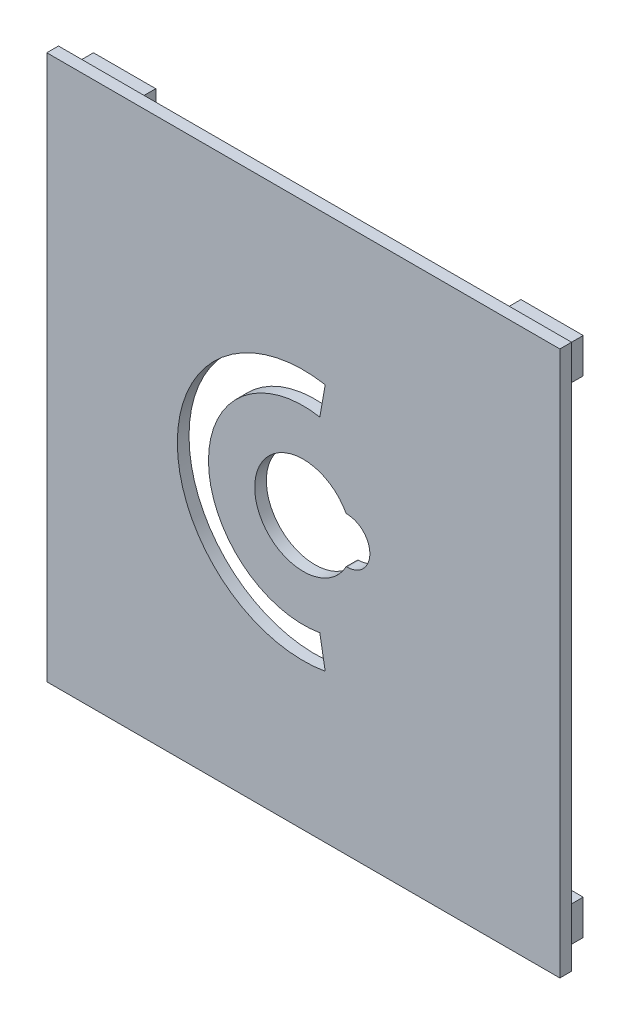
from build123d import *

# Parameters (mm, degrees)
SKETCH1_W                 = 65.925
SKETCH1_H                 = 70
BOSS_EXTRUDE1_DEPTH       = 1.5
CUT_EXTRUDE1_REACH        = 137.268
SKETCH4_W                 = 8
SKETCH4_H                 = 4.5
SKETCH4_W_2               = 5
SKETCH4_H_2               = 1.5
BOSS_EXTRUDE2_DEPTH       = 3
MIRROR2_COPY_1_SKETCH_W   = 8
MIRROR2_COPY_1_SKETCH_H   = 4.5
MIRROR2_COPY_1_SKETCH_W_2 = 5
MIRROR2_COPY_1_SKETCH_H_2 = 1.5
MIRROR2_COPY_1_DEPTH      = 3
CUT_EXTRUDE2_DEPTH        = 136.334853235


with BuildPart() as part:
    # Sketch1 → Boss-Extrude1 (new body)
    with BuildSketch(Plane.XY):
        with Locations((88.1375, 25.25)):
            Rectangle(SKETCH1_W, SKETCH1_H)
    extrude(amount=BOSS_EXTRUDE1_DEPTH)

    # Sketch2 → Cut-Extrude1 (cut, up to next)
    with BuildSketch(Plane.XY.offset(1.5), mode=Mode.PRIVATE) as cut_extrude1_sk1:
        with BuildLine():
            Line((93.647490926, 22.3), (93.7375, 22.3))
            ThreePointArc((93.7375, 22.3), (96.6875, 25.25), (93.7375, 28.2))
            Line((93.7375, 28.2), (93.647490926, 28.2))
            ThreePointArc((93.647490926, 28.2), (81.8875, 25.25), (93.647490926, 22.3))
        make_face()
    cut_extrude1_tool1 = extrude(cut_extrude1_sk1.sketch, amount=-CUT_EXTRUDE1_REACH, mode=Mode.PRIVATE) & part.part
    add(cut_extrude1_tool1.solids().sort_by_distance((88.730915, 25.25, 1.5))[0], mode=Mode.SUBTRACT)

    # Sketch4 → Boss-Extrude2 (add)
    with BuildSketch(Plane(origin=(0, 0, 0), x_dir=(-1, 0, 0), z_dir=(0, 0, -1))):
        with Locations((-115.6, 56.5)):
            Rectangle(SKETCH4_W, SKETCH4_H)
        with Locations((-115.6, 56.5)):
            Rectangle(SKETCH4_W_2, SKETCH4_H_2, mode=Mode.SUBTRACT)
    boss_extrude2 = extrude(amount=BOSS_EXTRUDE2_DEPTH)

    # Mirror1: Boss-Extrude2 across plane
    add(boss_extrude2.mirror(Plane(origin=(88.1375, 0, 0), x_dir=(0, 0, 1), z_dir=(1, 0, 0))))

    # Mirror2: Boss-Extrude2 across plane
    add(boss_extrude2.mirror(Plane.ZX.offset(25.25)))

    # Mirror2 copy 1 sketch → Mirror2 copy 1 (add)
    with BuildSketch(Plane(origin=(176.275, 50.5, 0), x_dir=(1, 0, 0), z_dir=(0, 0, -1))):
        with Locations((-115.6, 56.5)):
            Rectangle(MIRROR2_COPY_1_SKETCH_W, MIRROR2_COPY_1_SKETCH_H)
        with Locations((-115.6, 56.5)):
            Rectangle(MIRROR2_COPY_1_SKETCH_W_2, MIRROR2_COPY_1_SKETCH_H_2, mode=Mode.SUBTRACT)
    extrude(amount=MIRROR2_COPY_1_DEPTH)

    # Sketch5 → Cut-Extrude2 (cut, through all)
    with BuildSketch(Plane.XY.offset(1.5)):
        with BuildLine():
            Line((90.254036985, 37.253477721), (90.948629695, 41.192708733))
            ThreePointArc((90.948629695, 41.192708733), (71.948849287, 25.25), (90.948629695, 9.307291267))
            Line((90.948629695, 9.307291267), (90.254036985, 13.246522279))
            ThreePointArc((90.254036985, 13.246522279), (75.948849287, 25.25), (90.254036985, 37.253477721))
        make_face()
    extrude(amount=-CUT_EXTRUDE2_DEPTH, mode=Mode.SUBTRACT)


solid = part.part
